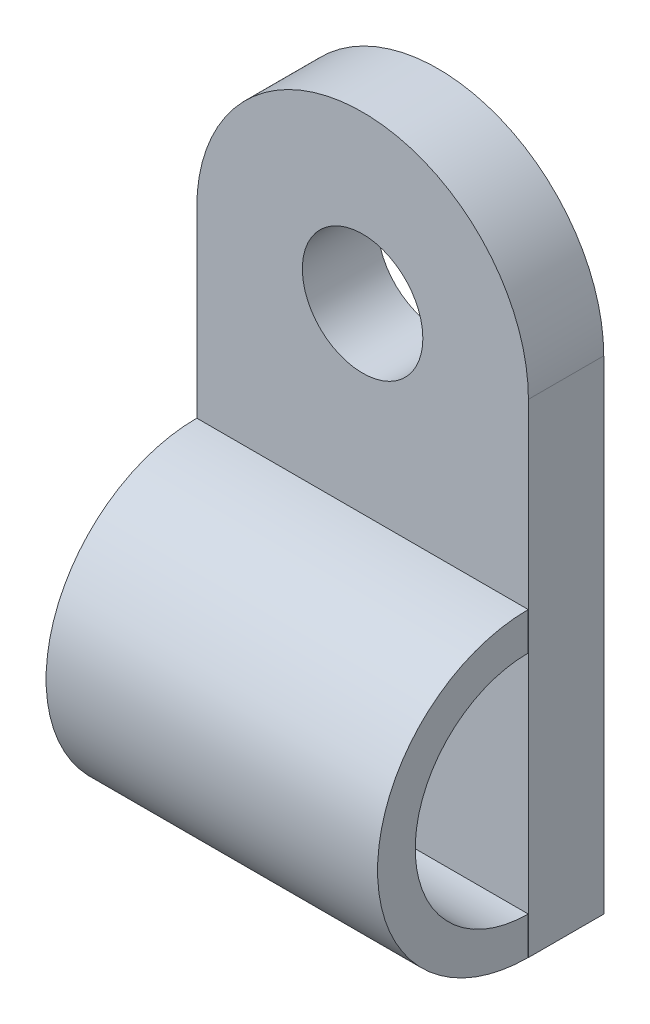
from build123d import *

# Parameters (mm, degrees)
SKETCH_1_R      = 4.402451684
SKETCH_1_R_2    = 1.6
EXTRUDE_1_DEPTH = 2
EXTRUDE_4_DEPTH = 8.8


with BuildPart() as part:
    # 草图1 → 凸台-拉伸1 (new body)
    # profile 1 of 2: a face of its own
    with BuildSketch(Plane.XY):
        Circle(SKETCH_1_R)
        Circle(SKETCH_1_R_2, mode=Mode.SUBTRACT)
    # profile 2 of 2: a face of its own
    with BuildSketch(Plane.XY):
        with BuildLine():
            ThreePointArc((4.402451684, 0), (0, -4.402451684), (-4.402451684, 0))
            Line((-4.402451684, 0), (-4.402451684, -12.835731795))
            Line((-4.402451684, -12.835731795), (4.402451684, -12.835731795))
            Line((4.402451684, -12.835731795), (4.402451684, 0))
        make_face()
    extrude(amount=EXTRUDE_1_DEPTH)

    # 草图4 → 凸台-拉伸4 (add)
    with BuildSketch(Plane.ZY.offset(4.402451684)):
        with BuildLine():
            ThreePointArc((6, -8.835731795), (4.828427125, -6.00730467), (2, -4.835731795))
            Line((2, -4.835731795), (2, -5.835731795))
            ThreePointArc((2, -5.835731795), (4.121320344, -6.714411452), (5, -8.835731795))
            ThreePointArc((5, -8.835731795), (4.121320344, -10.957052139), (2, -11.835731795))
            Line((2, -11.835731795), (2, -12.835731795))
            ThreePointArc((2, -12.835731795), (4.828427125, -11.66415892), (6, -8.835731795))
        make_face()
    extrude(amount=-EXTRUDE_4_DEPTH)


solid = part.part
